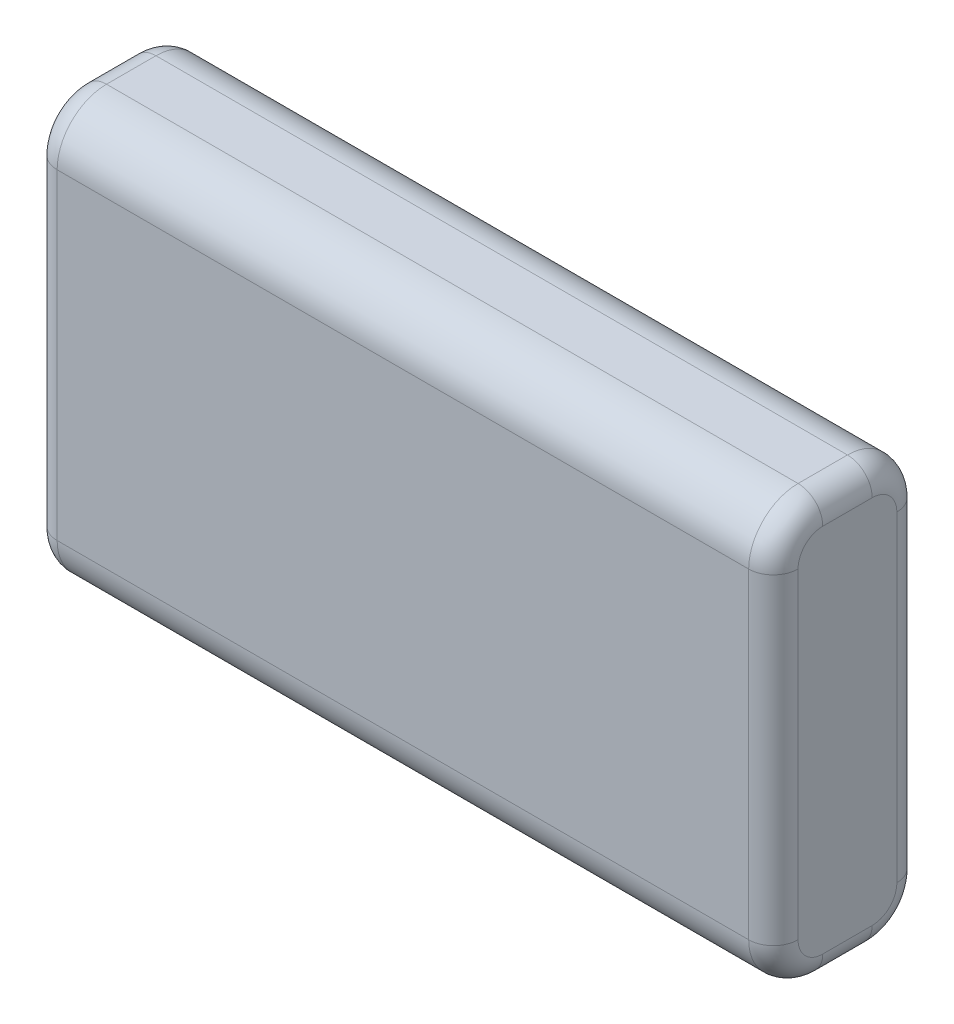
from build123d import *

# Parameters (mm, degrees)
SKETCH1_W           = 30
SKETCH1_H           = 17
BOSS_EXTRUDE1_DEPTH = 6
FILLET1_R           = 2
FILLET2_R           = 1


with BuildPart() as part:
    # Sketch1 → Boss-Extrude1 (new body)
    with BuildSketch(Plane.XY):
        with Locations((15, 8.5)):
            Rectangle(SKETCH1_W, SKETCH1_H)
    extrude(amount=BOSS_EXTRUDE1_DEPTH)

    # Fillet1
    fillet1_edges = [part.edges().sort_by_distance(p)[0] for p in [
        (15, 17, 6),
        (15, 17, 0),
        (15, 0, 0),
        (15, 0, 6),
    ]]
    fillet(fillet1_edges, radius=FILLET1_R)

    # Fillet2
    fillet2_edges = [part.edges().sort_by_distance(p)[0] for p in [
        (30, 0, 3),
        (0, 0, 3),
        (30, 8.5, 0),
        (30, 17, 3),
        (30, 8.5, 6),
        (30, 16.414213562, 0.585786438),
        (30, 16.414213562, 5.414213562),
        (30, 0.585786438, 5.414213562),
        (30, 0.585786438, 0.585786438),
        (0, 8.5, 0),
        (0, 8.5, 6),
        (0, 17, 3),
        (0, 16.414213562, 0.585786438),
        (0, 16.414213562, 5.414213562),
        (0, 0.585786438, 5.414213562),
        (0, 0.585786438, 0.585786438),
    ]]
    fillet(fillet2_edges, radius=FILLET2_R)


solid = part.part
